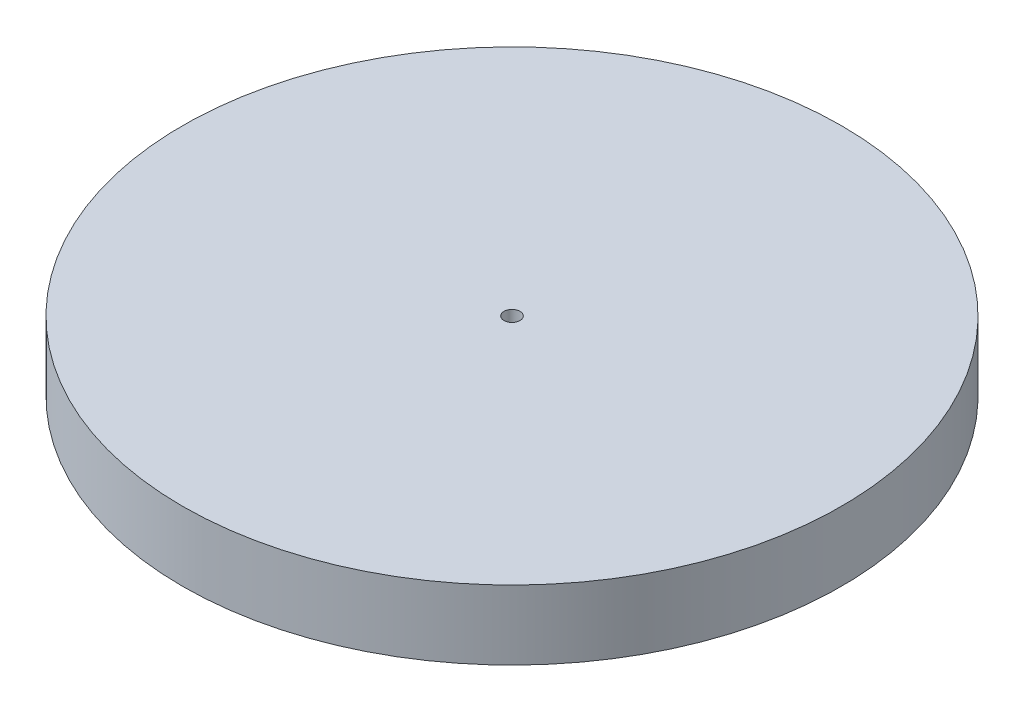
from build123d import *

# Parameters (mm, degrees)
SKETCH1_R           = 43.25
SKETCH1_R_2         = 1.05
BOSS_EXTRUDE1_DEPTH = 9.1


with BuildPart() as part:
    # Sketch1 → Boss-Extrude1 (new body)
    with BuildSketch(Plane(origin=(0, 0, 0), x_dir=(1, 0, 0), z_dir=(0, 1, 0))):
        with Locations(Location((0, 0, 0), (0, 0, 270))):
            Circle(SKETCH1_R)
        with Locations(Location((0, 0, 0), (0, 0, 270))):
            Circle(SKETCH1_R_2, mode=Mode.SUBTRACT)
    extrude(amount=BOSS_EXTRUDE1_DEPTH)


solid = part.part
